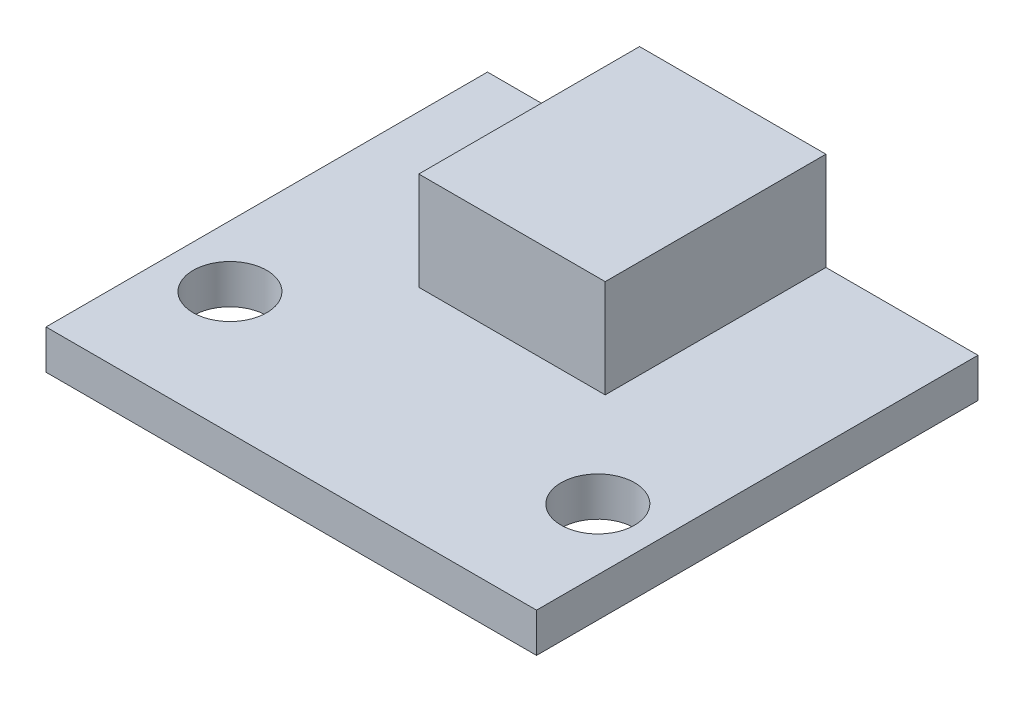
from build123d import *

# Parameters (mm, degrees)
SKETCH_1_W      = 20
SKETCH_1_H      = 18
SKETCH_1_R      = 1.5
EXTRUDE_1_DEPTH = 1.6
SKETCH_2_W      = 7.6
SKETCH_2_H      = 9
EXTRUDE_2_DEPTH = 4


with BuildPart() as part:
    # 草图1 → 凸台-拉伸1 (new body)
    with BuildSketch(Plane(origin=(0, 0, 0), x_dir=(1, 0, 0), z_dir=(0, 1, 0))):
        with Locations((10, 9)):
            Rectangle(SKETCH_1_W, SKETCH_1_H)
        with Locations(Location((2.5, 5, 0), (0, 0, 270))):
            Circle(SKETCH_1_R, mode=Mode.SUBTRACT)
        with Locations(Location((17.5, 5, 0), (0, 0, 90))):
            Circle(SKETCH_1_R, mode=Mode.SUBTRACT)
    extrude(amount=EXTRUDE_1_DEPTH)

    # 草图2 → 凸台-拉伸2 (add)
    with BuildSketch(Plane(origin=(0, 1.6, 0), x_dir=(1, 0, 0), z_dir=(0, 1, 0))):
        with Locations((10, 13.5)):
            Rectangle(SKETCH_2_W, SKETCH_2_H)
    extrude(amount=EXTRUDE_2_DEPTH)


solid = part.part
